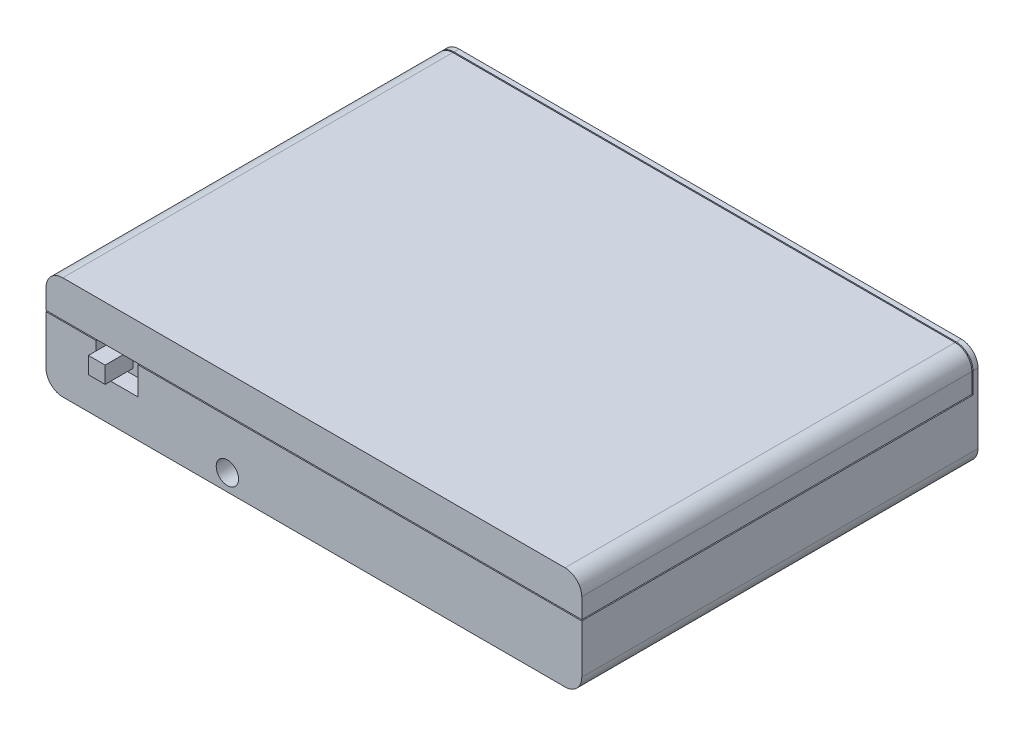
from build123d import *

# Parameters (mm, degrees)
BOX_DEPTH                         = 9.25
BOX_DEPTH_BACK                    = 9.25
SKETCH1_W                         = 96
SKETCH1_H                         = 71
SKETCH2_W                         = 7.5
SKETCH2_H                         = 5
SWITCH_HOLE_DEPTH                 = 3
SKETCH4_W                         = 3
SKETCH4_H                         = 3
SWITCH_DEPTH                      = 5
SKETCH5_R                         = 2
WIRE_HOLE_DEPTH                   = 5
SKETCH7_W                         = 96
SKETCH7_H                         = 0.2
LID_INDICATOR_FRONT_DEPTH         = 1
SKETCH8_W                         = 70
SKETCH8_H                         = 0.2
LID_INDICATOR_LEFT_DEPTH          = 1
SKETCH9_W                         = 70
SKETCH9_H                         = 0.2
LID_INDICATOR_RIGHT_DEPTH         = 1
SKETCH10_W                        = 96
SKETCH10_H                        = 0.2
LID_INDICATOR_TOP_DEPTH           = 1
SKETCH11_W                        = 0.2
SKETCH11_H                        = 5.75
LID_INDICATOR_LEFT_SNIPPET_DEPTH  = 1
SKETCH12_W                        = 0.2
SKETCH12_H                        = 5.75
LID_INDICATOR_RIGHT_SNIPPET_DEPTH = 1
BOTTOM_ROUND_R                    = 3
TOP_ROUND_R                       = 3


with BuildPart() as part:
    # Sketch1 → Box (new, two sides: drawn at the far end of the back side and taken through both)
    with BuildSketch(Plane(origin=(0, 0, 0), x_dir=(1, 0, 0), z_dir=(0, 1, 0)).offset(-BOX_DEPTH_BACK)):
        Rectangle(SKETCH1_W, SKETCH1_H)
    extrude(amount=BOX_DEPTH + BOX_DEPTH_BACK)

    # Sketch2 → Switch Hole (cut)
    with BuildSketch(Plane.XY.offset(35.5)):
        with Locations((-35.25, 0)):
            Rectangle(SKETCH2_W, SKETCH2_H)
    extrude(amount=-SWITCH_HOLE_DEPTH, mode=Mode.SUBTRACT)

    # Sketch4 → Switch (add)
    with BuildSketch(Plane.XY.offset(32.5)):
        with Locations((-36.90464297, 0)):
            Rectangle(SKETCH4_W, SKETCH4_H)
    extrude(amount=SWITCH_DEPTH)

    # Sketch5 → Wire Hole (cut)
    with BuildSketch(Plane.XY.offset(35.5)):
        with Locations((-15.5, -6.25)):
            Circle(SKETCH5_R)
    extrude(amount=-WIRE_HOLE_DEPTH, mode=Mode.SUBTRACT)

    # Sketch7 → Lid Indicator Front (cut)
    with BuildSketch(Plane.XY.offset(35.5)):
        with Locations((0, 2.6)):
            Rectangle(SKETCH7_W, SKETCH7_H)
    extrude(amount=-LID_INDICATOR_FRONT_DEPTH, mode=Mode.SUBTRACT)

    # Sketch8 → Lid Indicator Left (cut)
    with BuildSketch(Plane.ZY.offset(48)):
        with Locations((0.5, 2.6)):
            Rectangle(SKETCH8_W, SKETCH8_H)
    extrude(amount=-LID_INDICATOR_LEFT_DEPTH, mode=Mode.SUBTRACT)

    # Sketch9 → Lid Indicator Right (cut)
    with BuildSketch(Plane(origin=(48, 0, 0), x_dir=(0, 0, -1), z_dir=(1, 0, 0))):
        with Locations((-0.5, 2.6)):
            Rectangle(SKETCH9_W, SKETCH9_H)
    extrude(amount=-LID_INDICATOR_RIGHT_DEPTH, mode=Mode.SUBTRACT)

    # Sketch10 → Lid Indicator Top (cut)
    with BuildSketch(Plane(origin=(0, 9.25, 0), x_dir=(1, 0, 0), z_dir=(0, 1, 0))):
        with Locations((0, 34.5)):
            Rectangle(SKETCH10_W, SKETCH10_H)
    extrude(amount=-LID_INDICATOR_TOP_DEPTH, mode=Mode.SUBTRACT)

    # Sketch11 → Lid Indicator Left Snippet (cut)
    with BuildSketch(Plane.ZY.offset(48)):
        with Locations((-34.5, 5.375)):
            Rectangle(SKETCH11_W, SKETCH11_H)
    extrude(amount=-LID_INDICATOR_LEFT_SNIPPET_DEPTH, mode=Mode.SUBTRACT)

    # Sketch12 → Lid Indicator Right Snippet (cut)
    with BuildSketch(Plane(origin=(48, 0, 0), x_dir=(0, 0, -1), z_dir=(1, 0, 0))):
        with Locations((34.5, 5.375)):
            Rectangle(SKETCH12_W, SKETCH12_H)
    extrude(amount=-LID_INDICATOR_RIGHT_SNIPPET_DEPTH, mode=Mode.SUBTRACT)

    # Bottom ROund
    bottom_round_edges = [part.edges().sort_by_distance(p)[0] for p in [
        (48, -9.25, 0),
        (-48, -9.25, 0),
    ]]
    fillet(bottom_round_edges, radius=BOTTOM_ROUND_R)

    # Top Round
    top_round_edges = [part.edges().sort_by_distance(p)[0] for p in [
        (-48, 9.25, 0.55),
        (48, 9.25, 0.55),
        (-48, 9.25, -35.05),
        (48, 9.25, -35.05),
    ]]
    fillet(top_round_edges, radius=TOP_ROUND_R)


solid = part.part
